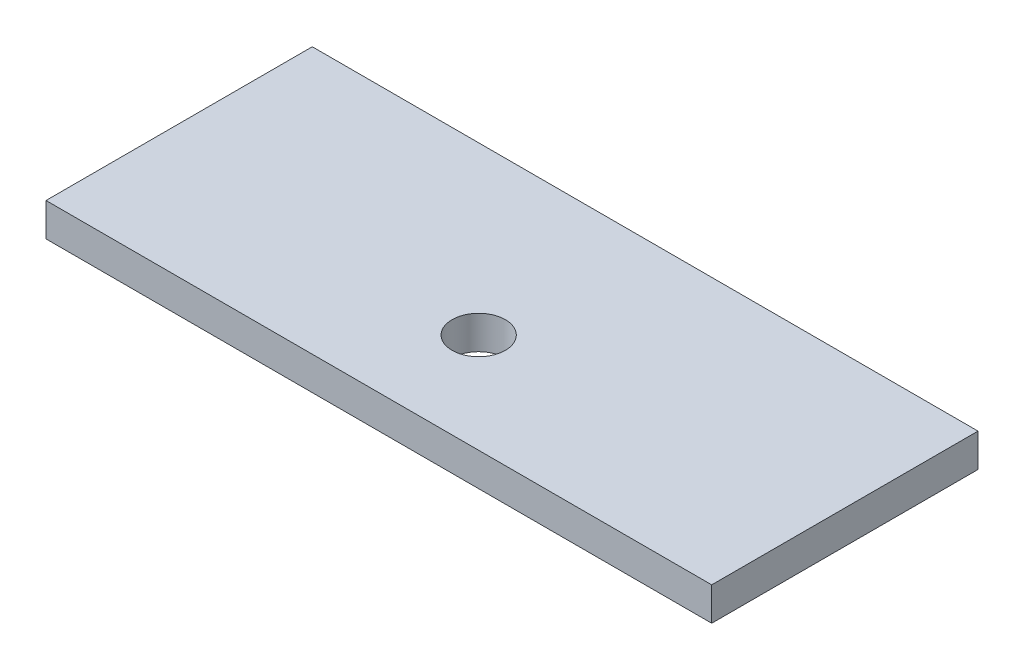
from build123d import *

# Parameters (mm, degrees)
CROQUIS1_W     = 100
CROQUIS1_H     = 40
EXTRUIR1_DEPTH = 5
CROQUIS2_R     = 4
EXTRUIR2_DEPTH = 5


with BuildPart() as part:
    # Croquis1 → Extruir1 (new body)
    with BuildSketch(Plane(origin=(0, 0, 0), x_dir=(1, 0, 0), z_dir=(0, 1, 0))):
        Rectangle(CROQUIS1_W, CROQUIS1_H)
    extrude(amount=EXTRUIR1_DEPTH)

    # Croquis2 → Extruir2 (cut)
    with BuildSketch(Plane(origin=(0, 5, 0), x_dir=(1, 0, 0), z_dir=(0, 1, 0))):
        with Locations(Location((0, -5, 0), (0, 0, 270))):
            Circle(CROQUIS2_R)
    extrude(amount=-EXTRUIR2_DEPTH, mode=Mode.SUBTRACT)


solid = part.part
